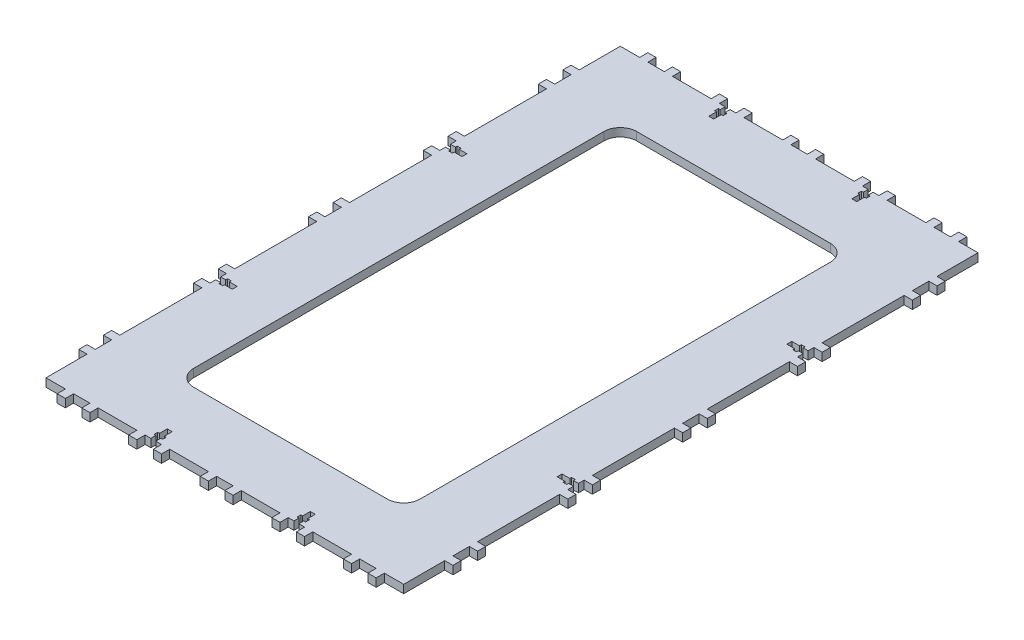
from build123d import *

# Parameters (mm, degrees)
BOSS_EXTRUDE1_DEPTH = 5


with BuildPart() as part:
    # Sketch1 → Boss-Extrude1 (new body)
    with BuildSketch(Plane(origin=(0, 0, 0), x_dir=(1, 0, 0), z_dir=(0, 1, 0))):
        Polygon((82.2, -180), (82.2, -175), (92.2, -175), (92.2, -180), (97.2, -180), (97.2, -175), (102.5, -175), (109, -175), (109, -150), (114, -150), (114, -145), (109, -145), (109, -141.5), (109, -138.5), (109, -135), (114, -135), (114, -130), (109, -130), (109, -80), (114, -80), (114, -75), (109, -75), (109, -71.5), (106, -71.5), (106, -72.6), (103.7, -72.6), (103.7, -71.5), (99, -71.5), (99, -68.5), (103.7, -68.5), (103.7, -67.4), (106, -67.4), (106, -68.5), (109, -68.5), (109, -65), (114, -65), (114, -60), (109, -60), (109, -10), (114, -10), (114, -5), (109, -5), (109, -1.5), (109, 1.5), (109, 5), (114, 5), (114, 10), (109, 10), (109, 60), (114, 60), (114, 65), (109, 65), (109, 68.5), (106, 68.5), (106, 67.4), (103.7, 67.4), (103.7, 68.5), (99, 68.5), (99, 71.5), (103.7, 71.5), (103.7, 72.6), (106, 72.6), (106, 71.5), (109, 71.5), (109, 75), (114, 75), (114, 80), (109, 80), (109, 130), (114, 130), (114, 135), (109, 135), (109, 138.5), (109, 141.5), (109, 145), (114, 145), (114, 150), (109, 150), (109, 175), (102.5, 175), (97.2, 175), (97.2, 180), (92.2, 180), (92.2, 175), (82.2, 175), (82.2, 180), (77.2, 180), (77.2, 175), (71.9, 175), (53.6, 175), (53.6, 180), (48.6, 180), (48.6, 175), (45.1, 175), (45.1, 172), (46.2, 172), (46.2, 169.7), (45.1, 169.7), (45.1, 165), (42.1, 165), (42.1, 169.7), (41, 169.7), (41, 172), (42.1, 172), (42.1, 175), (38.6, 175), (38.6, 180), (33.6, 180), (33.6, 175), (10, 175), (10, 180), (5, 180), (5, 175), (1.5, 175), (-1.5, 175), (-5, 175), (-5, 180), (-10, 180), (-10, 175), (-33.6, 175), (-33.6, 180), (-38.6, 180), (-38.6, 175), (-42.1, 175), (-42.1, 172), (-41, 172), (-41, 169.7), (-42.1, 169.7), (-42.1, 165), (-45.1, 165), (-45.1, 169.7), (-46.2, 169.7), (-46.2, 172), (-45.1, 172), (-45.1, 175), (-48.6, 175), (-48.6, 180), (-53.6, 180), (-53.6, 175), (-71.9, 175), (-77.2, 175), (-77.2, 180), (-82.2, 180), (-82.2, 175), (-92.2, 175), (-92.2, 180), (-97.2, 180), (-97.2, 175), (-102.5, 175), (-109, 175), (-109, 150), (-114, 150), (-114, 145), (-109, 145), (-109, 141.5), (-109, 138.5), (-109, 135), (-114, 135), (-114, 130), (-109, 130), (-109, 80), (-114, 80), (-114, 75), (-109, 75), (-109, 71.5), (-106, 71.5), (-106, 72.6), (-103.7, 72.6), (-103.7, 71.5), (-99, 71.5), (-99, 68.5), (-103.7, 68.5), (-103.7, 67.4), (-106, 67.4), (-106, 68.5), (-109, 68.5), (-109, 65), (-114, 65), (-114, 60), (-109, 60), (-109, 10), (-114, 10), (-114, 5), (-109, 5), (-109, 1.5), (-109, -1.5), (-109, -5), (-114, -5), (-114, -10), (-109, -10), (-109, -60), (-114, -60), (-114, -65), (-109, -65), (-109, -68.5), (-106, -68.5), (-106, -67.4), (-103.7, -67.4), (-103.7, -68.5), (-99, -68.5), (-99, -71.5), (-103.7, -71.5), (-103.7, -72.6), (-106, -72.6), (-106, -71.5), (-109, -71.5), (-109, -75), (-114, -75), (-114, -80), (-109, -80), (-109, -130), (-114, -130), (-114, -135), (-109, -135), (-109, -138.5), (-109, -141.5), (-109, -145), (-114, -145), (-114, -150), (-109, -150), (-109, -175), (-102.5, -175), (-97.2, -175), (-97.2, -180), (-92.2, -180), (-92.2, -175), (-82.2, -175), (-82.2, -180), (-77.2, -180), (-77.2, -175), (-71.9, -175), (-53.6, -175), (-53.6, -180), (-48.6, -180), (-48.6, -175), (-45.1, -175), (-45.1, -172), (-46.2, -172), (-46.2, -169.7), (-45.1, -169.7), (-45.1, -165), (-42.1, -165), (-42.1, -169.7), (-41, -169.7), (-41, -172), (-42.1, -172), (-42.1, -175), (-38.6, -175), (-38.6, -180), (-33.6, -180), (-33.6, -175), (-10, -175), (-10, -180), (-5, -180), (-5, -175), (-1.5, -175), (1.5, -175), (5, -175), (5, -180), (10, -180), (10, -175), (33.6, -175), (33.6, -180), (38.6, -180), (38.6, -175), (42.1, -175), (42.1, -172), (41, -172), (41, -169.7), (42.1, -169.7), (42.1, -165), (45.1, -165), (45.1, -169.7), (46.2, -169.7), (46.2, -172), (45.1, -172), (45.1, -175), (48.6, -175), (48.6, -180), (53.6, -180), (53.6, -175), (71.9, -175), (77.2, -175), (77.2, -180), align=None)
        with BuildLine():
            ThreePointArc((69, -125), (66.071067812, -132.071067812), (59, -135))
            Line((59, -135), (-59, -135))
            ThreePointArc((-59, -135), (-66.071067812, -132.071067812), (-69, -125))
            Line((-69, -125), (-69, 125))
            ThreePointArc((-69, 125), (-66.071067812, 132.071067812), (-59, 135))
            Line((-59, 135), (59, 135))
            ThreePointArc((59, 135), (66.071067812, 132.071067812), (69, 125))
            Line((69, 125), (69, -125))
        make_face(mode=Mode.SUBTRACT)
    extrude(amount=BOSS_EXTRUDE1_DEPTH)


solid = part.part
